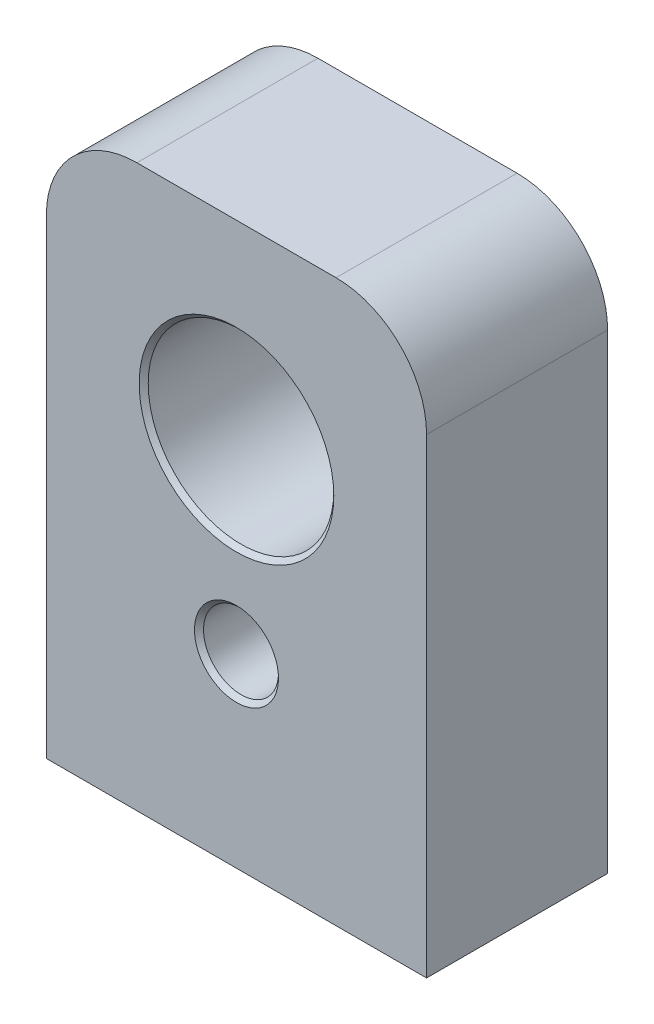
from build123d import *

# Parameters (mm, degrees)
SKETCH1_R           = 10.25
SKETCH1_R_2         = 4.14
BOSS_EXTRUDE1_DEPTH = 10
CHAMFER1_SIZE       = 0.5
CUT_EXTRUDE1_DEPTH  = 15.5


with BuildPart() as part:
    # Sketch1 → Boss-Extrude1 (new, symmetric)
    with BuildSketch(Plane.XY):
        with BuildLine():
            Line((-7.444896481, 30.480652594), (-29.444896481, 30.480652594))
            ThreePointArc((-29.444896481, 30.480652594), (-36.515964293, 27.551720406), (-39.444896481, 20.480652594))
            Line((-39.444896481, 20.480652594), (-39.444896481, -31.519347406))
            Line((-39.444896481, -31.519347406), (2.555103519, -31.519347406))
            Line((2.555103519, -31.519347406), (2.555103519, 20.480652594))
            ThreePointArc((2.555103519, 20.480652594), (-0.373828669, 27.551720406), (-7.444896481, 30.480652594))
        make_face()
        with Locations((-18.444896481, 9.480652594)):
            Circle(SKETCH1_R, mode=Mode.SUBTRACT)
        with Locations((-18.444896481, -11.019347406)):
            Circle(SKETCH1_R_2, mode=Mode.SUBTRACT)
    extrude(amount=BOSS_EXTRUDE1_DEPTH, both=True)

    # Chamfer1
    chamfer1_edges = [part.edges().sort_by_distance(p)[0] for p in [
        (-22.584896481, -11.019347406, -10),
        (-22.584896481, -11.019347406, 10),
        (-28.694896481, 9.480652594, -10),
        (-28.694896481, 9.480652594, 10),
    ]]
    chamfer(chamfer1_edges, length=CHAMFER1_SIZE)

    # Sketch3 → Cut-Extrude1 (cut)
    with BuildSketch(Plane(origin=(0, -31.519347406, 0), x_dir=(-1, 0, 0), z_dir=(0, -1, 0))):
        Polygon((33.444896481, -3.25), (36.259479043, -1.625), (36.259479043, 1.625), (33.444896481, 3.25), (30.630313919, 1.625), (30.630313919, -1.625), align=None)
    cut_extrude1 = extrude(amount=-CUT_EXTRUDE1_DEPTH, mode=Mode.SUBTRACT)

    # Mirror1: Cut-Extrude1 across plane
    add(cut_extrude1.mirror(Plane(origin=(-18.444896481, 0, 0), x_dir=(0, 0, 1), z_dir=(1, 0, 0))), mode=Mode.SUBTRACT)


solid = part.part
